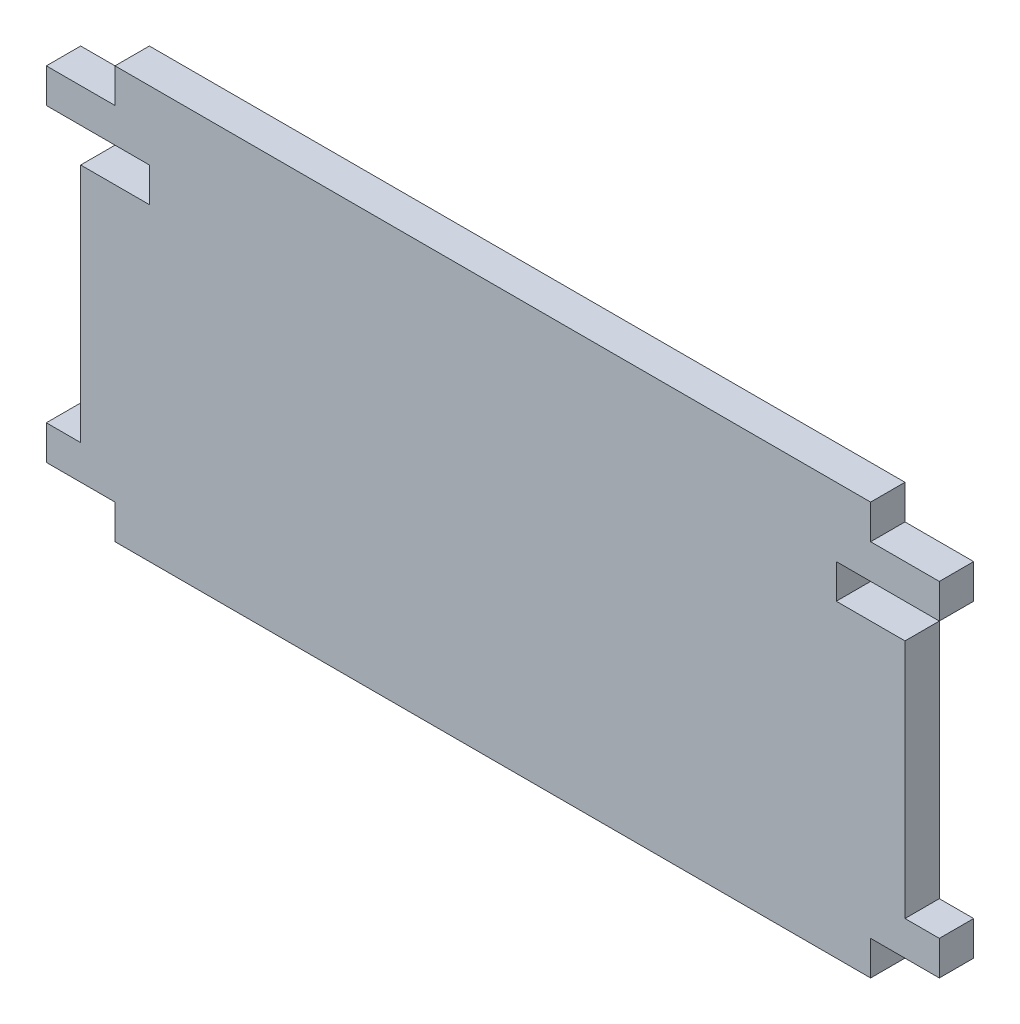
from build123d import *

# Parameters (mm, degrees)
BOSS_EXTRUDE1_DEPTH = 6.35
SKETCH2_W           = 19.05
SKETCH2_H           = 6.35
CUT_EXTRUDE1_DEPTH  = 131.484388434


with BuildPart() as part:
    # Sketch1 → Boss-Extrude1 (new body)
    with BuildSketch(Plane.XY):
        Polygon((107.95, 3.175), (107.95, 9.525), (101.6, 9.525), (101.6, 60.325), (107.95, 60.325), (107.95, 66.675), (95.25, 66.675), (95.25, 73.025), (-44.45, 73.025), (-44.45, 66.675), (-57.15, 66.675), (-57.15, 60.325), (-50.8, 60.325), (-50.8, 9.525), (-57.15, 9.525), (-57.15, 3.175), (-44.45, 3.175), (-44.45, -3.175), (95.25, -3.175), (95.25, 3.175), align=None)
    extrude(amount=-BOSS_EXTRUDE1_DEPTH)

    # Sketch2 → Cut-Extrude1 (cut, through all)
    with BuildSketch(Plane.XY):
        with Locations((98.425, 57.15)):
            Rectangle(SKETCH2_W, SKETCH2_H)
        with Locations((-47.625, 57.15)):
            Rectangle(SKETCH2_W, SKETCH2_H)
    extrude(amount=-CUT_EXTRUDE1_DEPTH, mode=Mode.SUBTRACT)


solid = part.part
